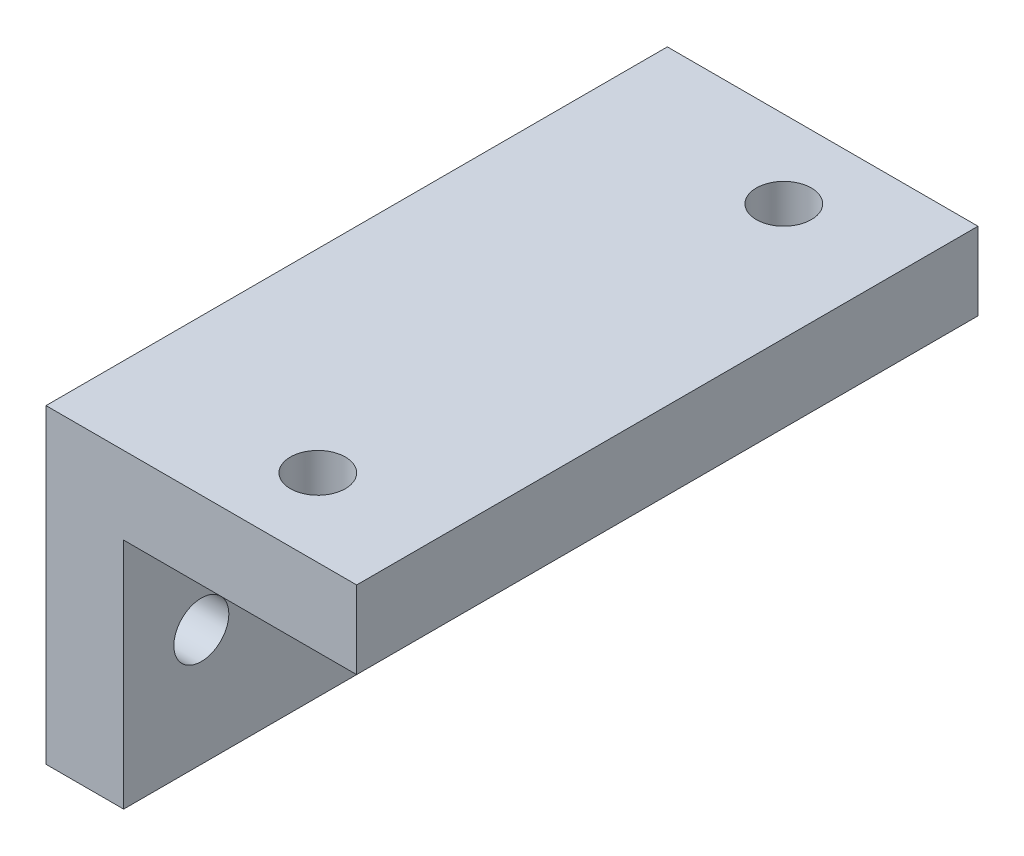
from build123d import *

# Parameters (mm, degrees)
BOSS_EXTRUDE1_DEPTH       = 25.4
F_8_CLEARANCE_HOLE1_D     = 4.4958
F_8_CLEARANCE_HOLE2_D     = 4.4958
F_8_CLEARANCE_HOLE2_DEPTH = 6.35
F_8_CLEARANCE_HOLE2_TIP   = 1.350674586


with BuildPart() as part:
    # Sketch1 → Boss-Extrude1 (new, symmetric)
    with BuildSketch(Plane.XY):
        Polygon((0, 0), (19.05, 0), (19.05, 6.35), (-6.35, 6.35), (-6.35, -19.05), (0, -19.05), align=None)
    extrude(amount=BOSS_EXTRUDE1_DEPTH, both=True)

    # #8 Clearance Hole1 (through all)
    with Locations(Plane(origin=(0, 0, 0), x_dir=(-1, 0, 0), z_dir=(0, -1, 0))):
        with Locations((-9.525, -19.05), (-9.525, 19.05)):
            Hole(F_8_CLEARANCE_HOLE1_D / 2)

    # #8 Clearance Hole2
    with Locations(Plane(origin=(0, 0, 0), x_dir=(0, 0, -1), z_dir=(1, 0, 0))):
        with Locations((19.05, -9.525), (-19.05, -9.525)):
            Hole(F_8_CLEARANCE_HOLE2_D / 2, depth=F_8_CLEARANCE_HOLE2_DEPTH)
            with Locations((0, 0, -(F_8_CLEARANCE_HOLE2_DEPTH + F_8_CLEARANCE_HOLE2_TIP / 2))):  # 118° drill point
                Cone(0, F_8_CLEARANCE_HOLE2_D / 2, F_8_CLEARANCE_HOLE2_TIP, mode=Mode.SUBTRACT)


solid = part.part
